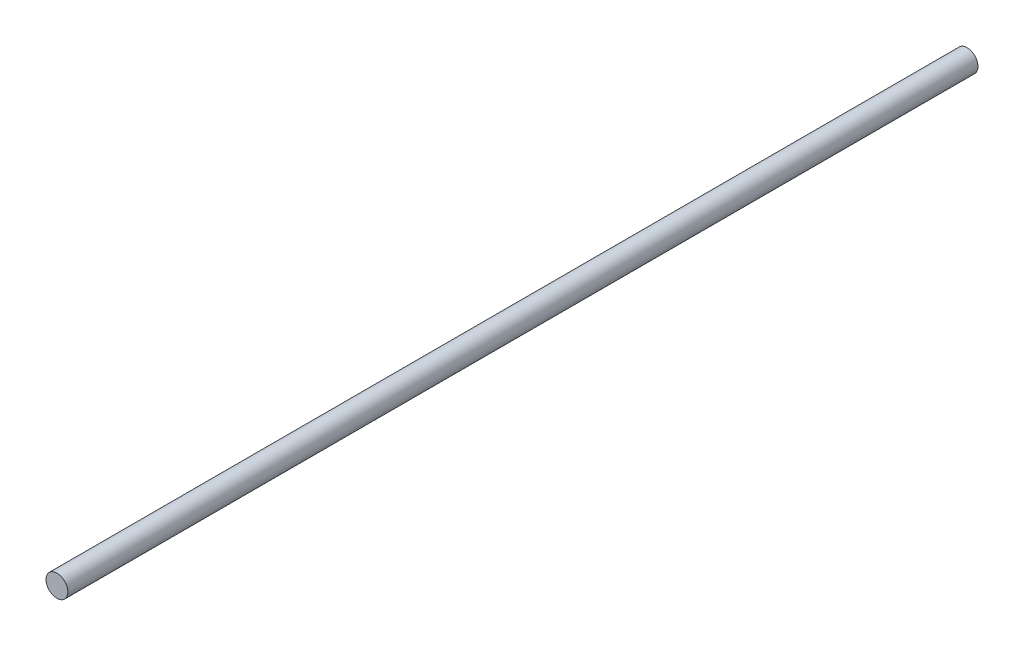
from build123d import *

# Parameters (mm, degrees)
SKETCH1_R           = 4.2
BOSS_EXTRUDE1_DEPTH = 175


with BuildPart() as part:
    # Sketch1 → Boss-Extrude1 (new, symmetric)
    with BuildSketch(Plane.XY):
        Circle(SKETCH1_R)
    extrude(amount=BOSS_EXTRUDE1_DEPTH, both=True)


solid = part.part
